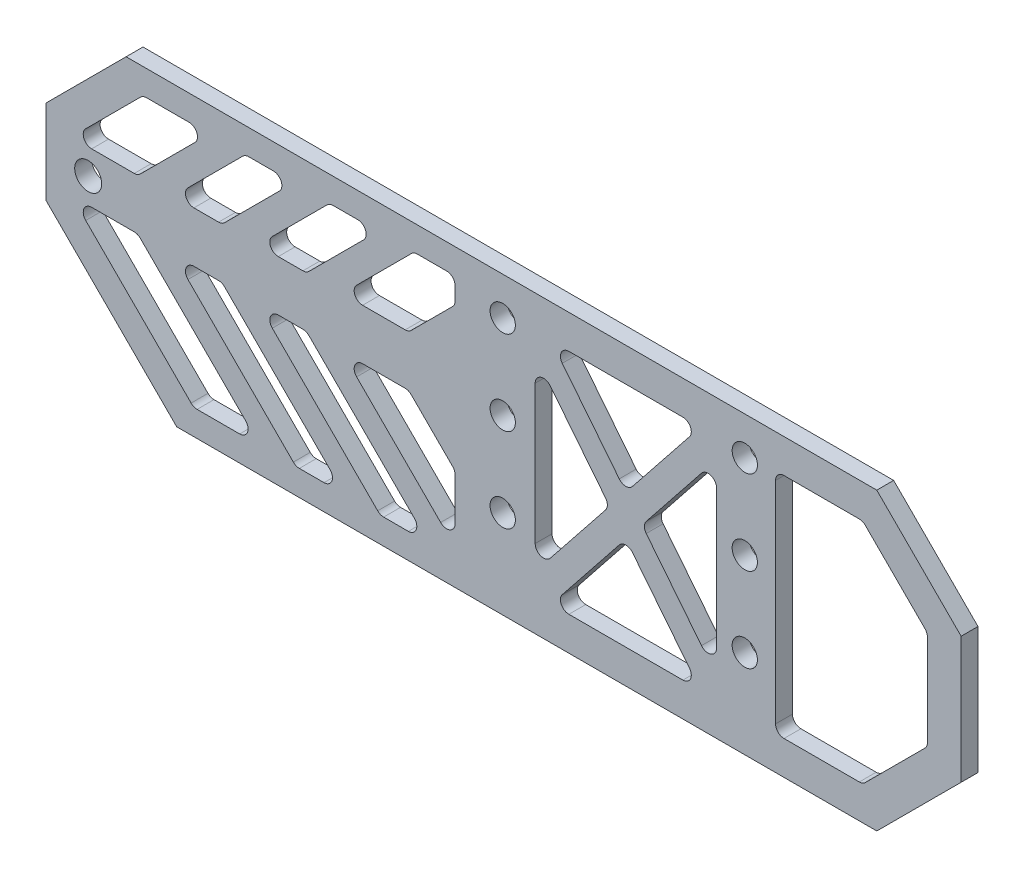
from build123d import *

# Parameters (mm, degrees)
SKETCH_1_W             = 32.7
SKETCH_1_H             = 29
SKETCH_1_R             = 1.5
EXTRUDE_1_DEPTH        = 2
CHAMFER_1_SIZE         = 3
EXTRUDE_2_DEPTH        = 2
CHAMFER_2_SIZE         = 9.5
EXTRUDE_3_DEPTH        = 2
SKETCH_6_R             = 1.6
CUT_EXTRUDE_2_DEPTH    = 72.529714105
CUT_EXTRUDE_4_DEPTH    = 10
FILLET_2_R             = 1
FILLET_2_OF_MIRROR_1_R = 1
SKETCH_8_W             = 55
SKETCH_8_H             = 35
CUT_EXTRUDE_5_DEPTH    = 72.529714105
EXTRUDE_4_DEPTH        = 2
CUT_EXTRUDE_6_DEPTH    = 72.529714105
FILLET_4_R             = 1


with BuildPart() as part:
    # 草图1 → 凸台-拉伸1 (new body)
    with BuildSketch(Plane.XY):
        Rectangle(SKETCH_1_W, SKETCH_1_H)
        with Locations((-14.35, -10)):
            Circle(SKETCH_1_R, mode=Mode.SUBTRACT)
        with Locations((-14.35, 10)):
            Circle(SKETCH_1_R, mode=Mode.SUBTRACT)
        with Locations((14.35, 10)):
            Circle(SKETCH_1_R, mode=Mode.SUBTRACT)
        with Locations((14.35, -10)):
            Circle(SKETCH_1_R, mode=Mode.SUBTRACT)
        with Locations((-14.35, 0)):
            Circle(SKETCH_1_R, mode=Mode.SUBTRACT)
        with Locations((14.35, 0)):
            Circle(SKETCH_1_R, mode=Mode.SUBTRACT)
    extrude(amount=EXTRUDE_1_DEPTH)

    # 倒角1
    chamfer_1_edges = [part.edges().sort_by_distance(p)[0] for p in [
        (16.35, -14.5, 1),
        (-16.35, -14.5, 1),
        (-16.35, 14.5, 1),
        (16.35, 14.5, 1),
    ]]
    chamfer(chamfer_1_edges, length=CHAMFER_1_SIZE)

    # 草图3 → 凸台-拉伸2 (add)
    with BuildSketch(Plane.XY.offset(2)):
        Polygon((-13.35, 14.5), (-68.5, 14.5), (-68.5, -14.5), (-13.35, -14.5), (-16.35, -11.5), (-16.35, 11.5), align=None)
        Polygon((68.5, 14.5), (13.35, 14.5), (16.35, 11.5), (16.35, -11.5), (13.35, -14.5), (68.5, -14.5), align=None)
    extrude(amount=-EXTRUDE_2_DEPTH)

    # 倒角2
    chamfer_2_edges = [part.edges().sort_by_distance(p)[0] for p in [
        (-68.5, -14.5, 1),
        (-68.5, 14.5, 1),
        (68.5, -14.5, 1),
        (68.5, 14.5, 1),
    ]]
    chamfer(chamfer_2_edges, length=CHAMFER_2_SIZE)

    # 草图4 → 凸台-拉伸3 (add)
    with BuildSketch(Plane(origin=(0, 0, 0), x_dir=(-1, 0, 0), z_dir=(0, 0, -1))):
        Polygon((-59, -14.5), (-53, -20.5), (53, -20.5), (59, -14.5), align=None)
    extrude(amount=-EXTRUDE_3_DEPTH)

    # 草图6 → 切除-拉伸2 (cut, through all)
    with BuildSketch(Plane(origin=(0, 0, 0), x_dir=(-1, 0, 0), z_dir=(0, 0, -1))):
        with Locations((-63.5, 0)):
            Circle(SKETCH_6_R)
    cut_extrude_2 = extrude(amount=-CUT_EXTRUDE_2_DEPTH, mode=Mode.SUBTRACT)

    # 草图7 → 切除-拉伸4 (cut)
    with BuildSketch(Plane(origin=(0, 0, 0), x_dir=(-1, 0, 0), z_dir=(0, 0, -1))):
        Polygon((-57, 11.5), (-65.5, 3), (-57.621320344, 3), (-49.121320344, 11.5), align=None)
        Polygon((-57.621320344, -3), (-65.5, -3), (-51, -17.5), (-43.121320344, -17.5), align=None)
        Polygon((-47.621320344, -3), (-53.378679656, -3), (-38.878679656, -17.5), (-33.121320344, -17.5), align=None)
        Polygon((-44.878679656, 11.5), (-53.378679656, 3), (-47.621320344, 3), (-39.121320344, 11.5), align=None)
        Polygon((-34.878679656, 11.5), (-43.378679656, 3), (-37.621320344, 3), (-29.121320344, 11.5), align=None)
        Polygon((-23.121320344, -17.5), (-37.621320344, -3), (-43.378679656, -3), (-28.878679656, -17.5), align=None)
        Polygon((-20, -8.5), (-25.5, -3), (-33.378679656, -3), (-20, -16.378679656), align=None)
        Polygon((-33.378679656, 3), (-25.5, 3), (-20, 8.5), (-20, 11.5), (-23, 11.5), (-24.878679656, 11.5), align=None)
    cut_extrude_4 = extrude(amount=-CUT_EXTRUDE_4_DEPTH, mode=Mode.SUBTRACT)

    # 圆角2
    fillet_2_edges = [part.edges().sort_by_distance(p)[0] for p in [
        (53.378679656, -3, 1),
        (47.621320344, -3, 1),
        (33.121320344, -17.5, 1),
        (38.878679656, -17.5, 1),
        (57.621320344, -3, 1),
        (43.121320344, -17.5, 1),
        (51, -17.5, 1),
        (65.5, -3, 1),
        (37.621320344, 3, 1),
        (43.378679656, 3, 1),
        (34.878679656, 11.5, 1),
        (29.121320344, 11.5, 1),
        (47.621320344, 3, 1),
        (53.378679656, 3, 1),
        (44.878679656, 11.5, 1),
        (39.121320344, 11.5, 1),
        (33.378679656, -3, 1),
        (25.5, -3, 1),
        (20, -8.5, 1),
        (20, -16.378679656, 1),
        (43.378679656, -3, 1),
        (37.621320344, -3, 1),
        (23.121320344, -17.5, 1),
        (28.878679656, -17.5, 1),
        (33.378679656, 3, 1),
        (24.878679656, 11.5, 1),
        (20, 11.5, 1),
        (20, 8.5, 1),
        (25.5, 3, 1),
        (57.621320344, 3, 1),
        (65.5, 3, 1),
        (57, 11.5, 1),
        (49.121320344, 11.5, 1),
    ]]
    fillet(fillet_2_edges, radius=FILLET_2_R)

    # 镜向1: 切除-拉伸2, 切除-拉伸4 across plane
    add(cut_extrude_2.mirror(Plane(origin=(0, 0, 0), x_dir=(0, 0, 1), z_dir=(1, 0, 0))), mode=Mode.SUBTRACT)
    add(cut_extrude_4.mirror(Plane(origin=(0, 0, 0), x_dir=(0, 0, 1), z_dir=(1, 0, 0))), mode=Mode.SUBTRACT)

    # 圆角2 of 镜向1
    fillet_2_of_mirror_1_edges = [part.edges().sort_by_distance(p)[0] for p in [
        (-53.378679656, -3, 1),
        (-47.621320344, -3, 1),
        (-33.121320344, -17.5, 1),
        (-38.878679656, -17.5, 1),
        (-57.621320344, -3, 1),
        (-43.121320344, -17.5, 1),
        (-51, -17.5, 1),
        (-65.5, -3, 1),
        (-37.621320344, 3, 1),
        (-43.378679656, 3, 1),
        (-34.878679656, 11.5, 1),
        (-29.121320344, 11.5, 1),
        (-47.621320344, 3, 1),
        (-53.378679656, 3, 1),
        (-44.878679656, 11.5, 1),
        (-39.121320344, 11.5, 1),
        (-33.378679656, -3, 1),
        (-25.5, -3, 1),
        (-20, -8.5, 1),
        (-20, -16.378679656, 1),
        (-43.378679656, -3, 1),
        (-37.621320344, -3, 1),
        (-23.121320344, -17.5, 1),
        (-28.878679656, -17.5, 1),
        (-33.378679656, 3, 1),
        (-24.878679656, 11.5, 1),
        (-20, 11.5, 1),
        (-20, 8.5, 1),
        (-25.5, 3, 1),
        (-57.621320344, 3, 1),
        (-65.5, 3, 1),
        (-57, 11.5, 1),
        (-49.121320344, 11.5, 1),
    ]]
    fillet(fillet_2_of_mirror_1_edges, radius=FILLET_2_OF_MIRROR_1_R)

    # 草图8 → 切除-拉伸5 (cut, through all)
    with BuildSketch(Plane.XY.offset(2)):
        with Locations((47.5, -3)):
            Rectangle(SKETCH_8_W, SKETCH_8_H)
    extrude(amount=-CUT_EXTRUDE_5_DEPTH, mode=Mode.SUBTRACT)

    # 草图9 → 凸台-拉伸4 (add)
    with BuildSketch(Plane.XY.offset(2)):
        Polygon((20, -20.5), (20, 14.5), (30, 14.5), (40, 4.5), (40, -10.5), (30, -20.5), align=None)
    extrude(amount=-EXTRUDE_4_DEPTH)

    # 草图10 → 切除-拉伸6 (cut, through all)
    with BuildSketch(Plane.XY.offset(2)):
        Polygon((9.082528349, 10.5), (-8.582528349, 10.5), (0.25, -0.592012346), align=None)
        Polygon((11, -14.092012346), (11, 8.092012346), (2.167471651, -3), align=None)
        Polygon((-1.667471651, -3), (-10.5, 8.092012346), (-10.5, -14.092012346), align=None)
        Polygon((0.25, -5.407987654), (-8.582528349, -16.5), (9.082528349, -16.5), align=None)
        Polygon((18, -16.5), (18, 10.5), (28.343145751, 10.5), (36, 2.843145751), (36, -8.843145751), (28.343145751, -16.5), align=None)
    extrude(amount=-CUT_EXTRUDE_6_DEPTH, mode=Mode.SUBTRACT)

    # 圆角4
    fillet_4_edges = [part.edges().sort_by_distance(p)[0] for p in [
        (2.167471651, -3, 1),
        (11, 8.092012346, 1),
        (11, -14.092012346, 1),
        (-10.5, 8.092012346, 1),
        (-1.667471651, -3, 1),
        (-10.5, -14.092012346, 1),
        (0.25, -5.407987654, 1),
        (9.082528349, -16.5, 1),
        (-8.582528349, -16.5, 1),
        (18, -16.5, 1),
        (18, 10.5, 1),
        (28.343145751, 10.5, 1),
        (36, 2.843145751, 1),
        (36, -8.843145751, 1),
        (28.343145751, -16.5, 1),
        (-8.582528349, 10.5, 1),
        (9.082528349, 10.5, 1),
        (0.25, -0.592012346, 1),
    ]]
    fillet(fillet_4_edges, radius=FILLET_4_R)


solid = part.part
